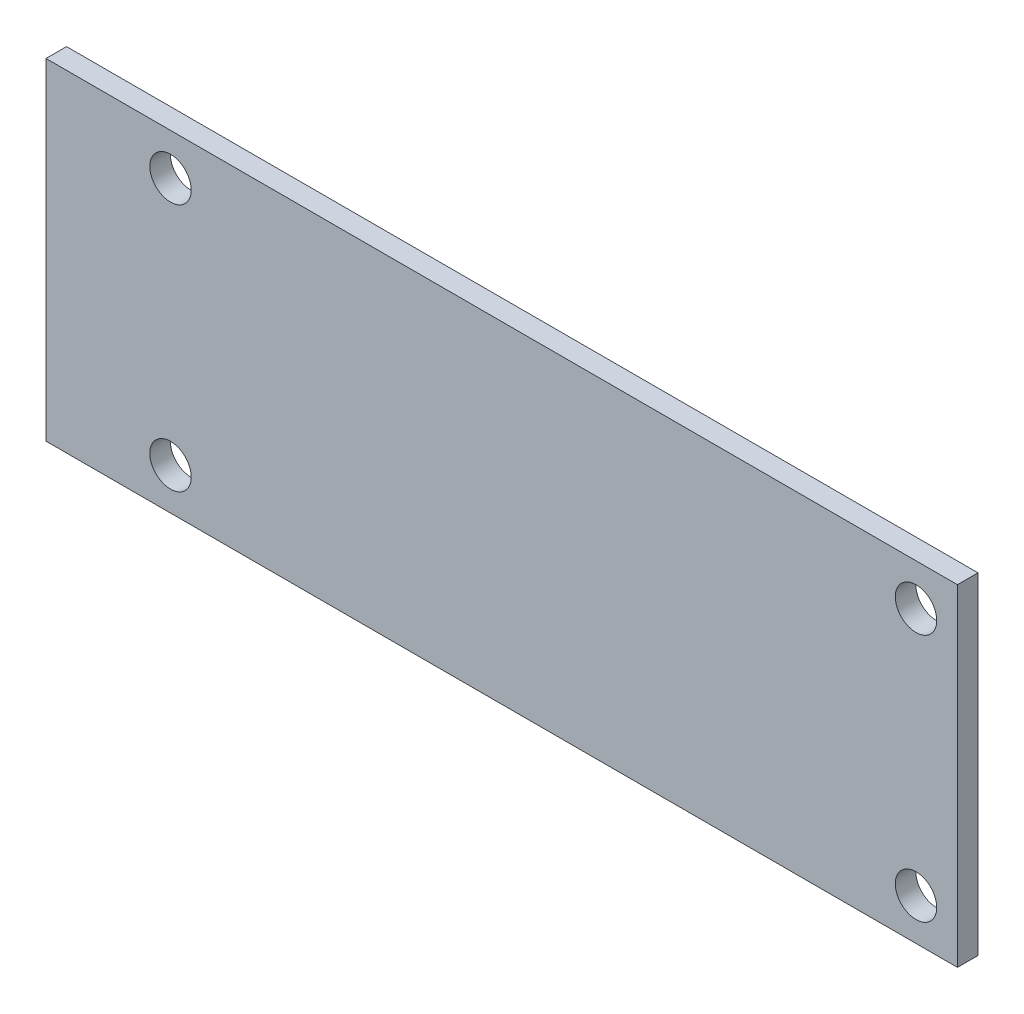
from build123d import *

# Parameters (mm, degrees)
SKETCH1_W                             = 69.85
SKETCH1_H                             = 25.4
EXTRUDE1_DEPTH                        = 1.5748
F_1_8_0_125_DIAMETER_HOLE1_AT_2_COUNT = 2
F_1_8_0_125_DIAMETER_HOLE1_AT_2_PITCH = 57.13222


with BuildPart() as part:
    # Sketch1 → Extrude1 (new body)
    with BuildSketch(Plane.XY):
        Rectangle(SKETCH1_W, SKETCH1_H)
    extrude(amount=EXTRUDE1_DEPTH)

    # Sketch3 → 1/8 (0.125) Diameter Hole1 (revolve, cut)
    with BuildSketch(Plane(origin=(-25.38222, 9.525, 1.5748), x_dir=(0, -1, 0), z_dir=(1, 0, 0))):
        Polygon((0, 0), (0, 16.955866233), (1.5875, 16.002), (1.5875, 0), align=None)
    f_1_8_0_125_diameter_hole1 = revolve(axis=Axis((-25.38222, 9.525, 7.9248), (0, 0, -1)), mode=Mode.SUBTRACT)

    # 1/8 (0.125) Diameter Hole1 at 2: 1/8 (0.125) Diameter Hole1 ×2
    with Locations(*[(i * F_1_8_0_125_DIAMETER_HOLE1_AT_2_PITCH, 0, 0) for i in range(1, F_1_8_0_125_DIAMETER_HOLE1_AT_2_COUNT)]):
        add(f_1_8_0_125_diameter_hole1, mode=Mode.SUBTRACT)

    # Mirror1: 1/8 (0.125) Diameter Hole1 across plane
    add(f_1_8_0_125_diameter_hole1.mirror(Plane.ZX), mode=Mode.SUBTRACT)

    # Mirror1 copy 1 sketch → Mirror1 copy 1 (revolve, cut)
    with BuildSketch(Plane(origin=(31.75, -9.525, 1.5748), x_dir=(0, 1, 0), z_dir=(1, 0, 0))):
        Polygon((0, 0), (0, -16.955866233), (1.5875, -16.002), (1.5875, 0), align=None)
    revolve(axis=Axis((31.75, -9.525, 7.9248), (0, 0, 1)), mode=Mode.SUBTRACT)


solid = part.part
